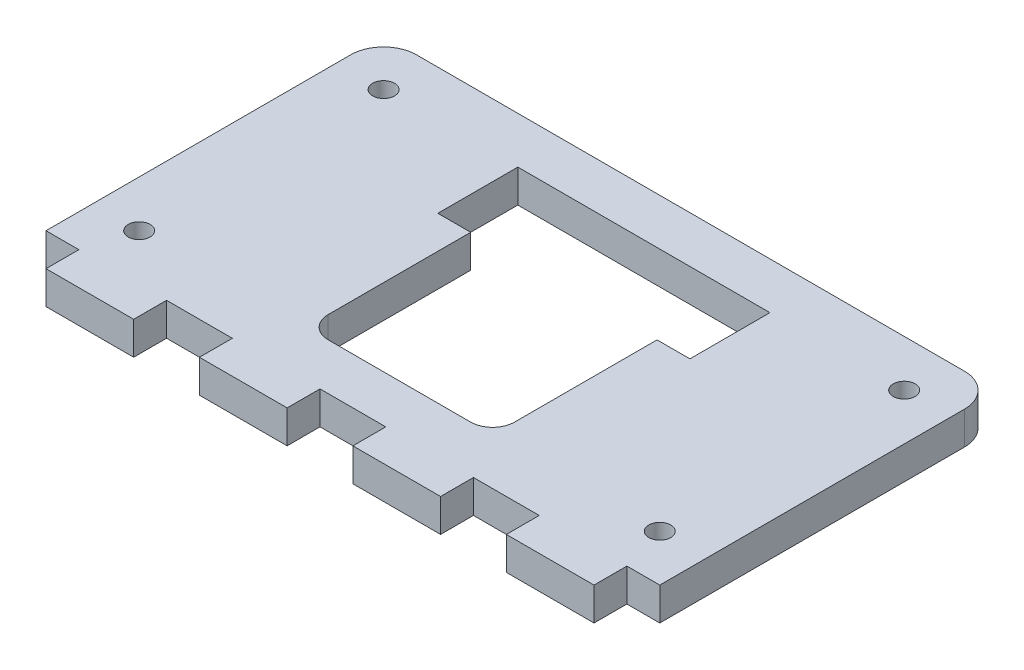
from build123d import *

# Parameters (mm, degrees)
ESQUISSE1_R        = 1
BOSS_EXTRU_1_DEPTH = 3


with BuildPart() as part:
    # Esquisse1 → Boss.-Extru.1 (new body)
    with BuildSketch(Plane(origin=(0, 0, 0), x_dir=(1, 0, 0), z_dir=(0, 1, 0))):
        with BuildLine():
            Line((-28, -30.8), (-25, -30.8))
            Line((-25, -30.8), (-25, -33.8))
            Line((-25, -33.8), (-17, -33.8))
            Line((-17, -33.8), (-17, -30.8))
            Line((-17, -30.8), (-11, -30.8))
            Line((-11, -30.8), (-11, -33.8))
            Line((-11, -33.8), (-3, -33.8))
            Line((-3, -33.8), (-3, -30.8))
            Line((-3, -30.8), (3, -30.8))
            Line((3, -30.8), (3, -33.8))
            Line((3, -33.8), (11, -33.8))
            Line((11, -33.8), (11, -30.8))
            Line((11, -30.8), (17, -30.8))
            Line((17, -30.8), (17, -33.8))
            Line((17, -33.8), (25, -33.8))
            Line((25, -33.8), (25, -30.8))
            Line((25, -30.8), (28, -30.8))
            Line((28, -30.8), (28, -3))
            ThreePointArc((28, -3), (27.121320344, -0.878679656), (25, 0))
            Line((25, 0), (-25, 0))
            ThreePointArc((-25, 0), (-27.121320344, -0.878679656), (-28, -3))
            Line((-28, -3), (-28, -30.8))
        make_face()
        with Locations(Location((-23.75, -4.25, 0), (0, 0, 270))):
            Circle(ESQUISSE1_R, mode=Mode.SUBTRACT)
        with Locations(Location((-23.75, -26.55, 0), (0, 0, 270))):
            Circle(ESQUISSE1_R, mode=Mode.SUBTRACT)
        with Locations(Location((23.75, -26.55, 0), (0, 0, 270))):
            Circle(ESQUISSE1_R, mode=Mode.SUBTRACT)
        with Locations(Location((23.75, -4.25, 0), (0, 0, 270))):
            Circle(ESQUISSE1_R, mode=Mode.SUBTRACT)
        with BuildLine():
            Line((-11.5, -11.55), (-8.5, -11.55))
            Line((-8.5, -11.55), (-8.5, -24.55))
            ThreePointArc((-8.5, -24.55), (-7.914213562, -25.964213562), (-6.5, -26.55))
            Line((-6.5, -26.55), (6.5, -26.55))
            ThreePointArc((6.5, -26.55), (7.914213562, -25.964213562), (8.5, -24.55))
            Line((8.5, -24.55), (8.5, -11.55))
            Line((8.5, -11.55), (11.5, -11.55))
            Line((11.5, -11.55), (11.5, -4.25))
            Line((11.5, -4.25), (-11.5, -4.25))
            Line((-11.5, -4.25), (-11.5, -11.55))
        make_face(mode=Mode.SUBTRACT)
    extrude(amount=BOSS_EXTRU_1_DEPTH)


solid = part.part
